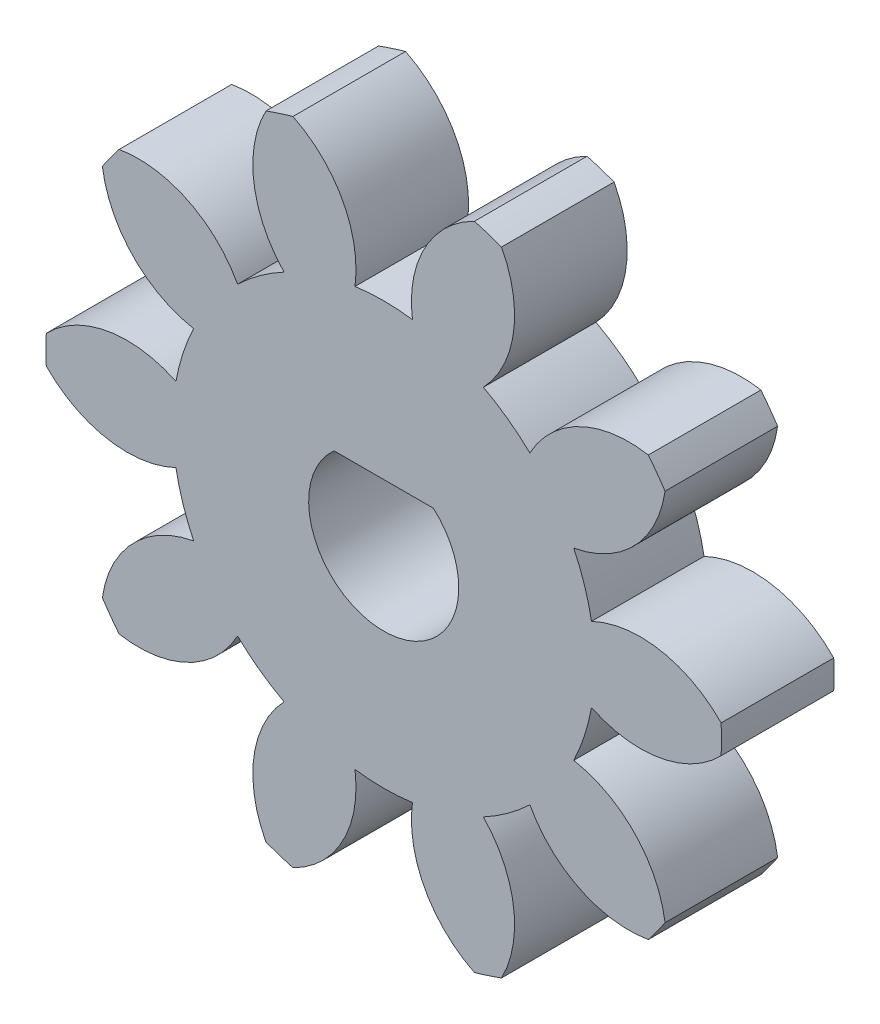
from build123d import *

# Parameters (mm, degrees)
SKETCH3_R           = 9
BOSS_EXTRUDE1_DEPTH = 3
CUT_EXTRUDE1_DEPTH  = 3
CIRPATTERN1_COUNT   = 10
CUT_EXTRUDE8_DEPTH  = 71.5


with BuildPart() as part:
    # Sketch3 → Boss-Extrude1 (new body)
    with BuildSketch(Plane.XY):
        Circle(SKETCH3_R)
    extrude(amount=BOSS_EXTRUDE1_DEPTH)

    # Sketch4 → Cut-Extrude1 (cut)
    with BuildSketch(Plane(origin=(0, 0, 0), x_dir=(-1, 0, 0), z_dir=(0, 0, -1))):
        with BuildLine():
            ThreePointArc((0.76495134, 5.572743889), (0, 5.625), (-0.76495134, 5.572743889))
            ThreePointArc((-0.76495134, 5.572743889), (-1.091553585, 7.387918037), (-2.41833102, 8.669006579))
            ThreePointArc((-2.41833102, 8.669006579), (0, 9), (2.41833102, 8.669006579))
            ThreePointArc((2.41833102, 8.669006579), (1.091553585, 7.387918037), (0.76495134, 5.572743889))
        make_face()
    cut_extrude1 = extrude(amount=-CUT_EXTRUDE1_DEPTH, mode=Mode.SUBTRACT)

    # CirPattern1: Cut-Extrude1 ×10 about axis
    cirpattern1_axis = Axis((0, 0, 3), (0, 0, 1))
    for i in range(1, CIRPATTERN1_COUNT):
        add(cut_extrude1.rotate(cirpattern1_axis, i * 360 / CIRPATTERN1_COUNT), mode=Mode.SUBTRACT)

    # Sketch6 → Cut-Extrude8 (cut)
    with BuildSketch(Plane(origin=(0, 0, 0), x_dir=(-1, 0, 0), z_dir=(0, 0, -1))):
        with BuildLine():
            Line((-1.322875656, 1.5), (1.322875656, 1.5))
            ThreePointArc((1.322875656, 1.5), (0, -2), (-1.322875656, 1.5))
        make_face()
    extrude(amount=-CUT_EXTRUDE8_DEPTH, mode=Mode.SUBTRACT)


solid = part.part
